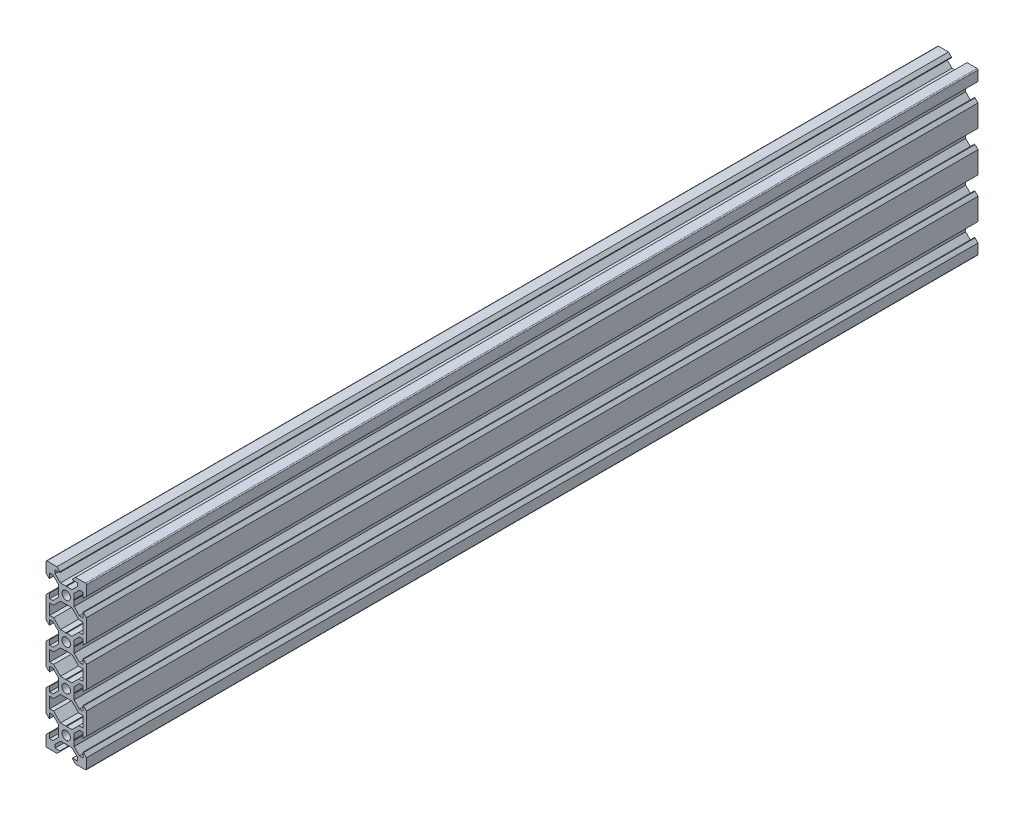
from build123d import *

# Parameters (mm, degrees)
BOSS_EXTRU_1_DEPTH = 441.2


with BuildPart() as part:
    # Esquisse1 → Boss.-Extru.1 (new body)
    with BuildSketch(Plane.XY):
        with BuildLine():
            Line((-9.5, 10), (-4.58, 10))
            Line((-4.58, 10), (-3.125, 8.545))
            Line((-3.125, 8.545), (-3.125, 8.2))
            Line((-3.125, 8.2), (-5.5, 8.2))
            Line((-5.5, 8.2), (-5.5, 6.560660172))
            Line((-5.5, 6.560660172), (-2.839339828, 3.9))
            Line((-2.839339828, 3.9), (-0.21, 3.9))
            Line((-0.21, 3.9), (0, 3.69))
            Line((0, 3.69), (0, 2.1))
            ThreePointArc((0, 2.1), (-2.1, 0), (0, -2.1))
            Line((0, -2.1), (0, -3.69))
            Line((0, -3.69), (-0.21, -3.9))
            Line((-0.21, -3.9), (-2.839339828, -3.9))
            Line((-2.839339828, -3.9), (-6.239339828, -7.3))
            Line((-6.239339828, -7.3), (-8.2, -7.3))
            Line((-8.2, -7.3), (-8.2, -12.7))
            Line((-8.2, -12.7), (-6.239339828, -12.7))
            Line((-6.239339828, -12.7), (-2.839339828, -16.1))
            Line((-2.839339828, -16.1), (-0.21, -16.1))
            Line((-0.21, -16.1), (0, -16.31))
            Line((0, -16.31), (0, -17.9))
            ThreePointArc((0, -17.9), (-2.1, -20), (0, -22.1))
            Line((0, -22.1), (0, -23.69))
            Line((0, -23.69), (-0.21, -23.9))
            Line((-0.21, -23.9), (-2.839339828, -23.9))
            Line((-2.839339828, -23.9), (-6.239339828, -27.3))
            Line((-6.239339828, -27.3), (-8.2, -27.3))
            Line((-8.2, -27.3), (-8.2, -32.7))
            Line((-8.2, -32.7), (-6.239339828, -32.7))
            Line((-6.239339828, -32.7), (-2.839339828, -36.1))
            Line((-2.839339828, -36.1), (-0.21, -36.1))
            Line((-0.21, -36.1), (0, -36.31))
            Line((0, -36.31), (0, -37.9))
            ThreePointArc((0, -37.9), (-2.1, -40), (0, -42.1))
            Line((0, -42.1), (0, -43.69))
            Line((0, -43.69), (-0.21, -43.9))
            Line((-0.21, -43.9), (-2.839339828, -43.9))
            Line((-2.839339828, -43.9), (-6.239339828, -47.3))
            Line((-6.239339828, -47.3), (-8.2, -47.3))
            Line((-8.2, -47.3), (-8.2, -52.7))
            Line((-8.2, -52.7), (-6.239339828, -52.7))
            Line((-6.239339828, -52.7), (-2.839339828, -56.1))
            Line((-2.839339828, -56.1), (-0.21, -56.1))
            Line((-0.21, -56.1), (0, -56.31))
            Line((0, -56.31), (0, -57.9))
            ThreePointArc((0, -57.9), (-2.1, -60), (0, -62.1))
            Line((0, -62.1), (0, -63.69))
            Line((0, -63.69), (-0.21, -63.9))
            Line((-0.21, -63.9), (-2.839339828, -63.9))
            Line((-2.839339828, -63.9), (-5.5, -66.560660172))
            Line((-5.5, -66.560660172), (-5.5, -68.2))
            Line((-5.5, -68.2), (-3.125, -68.2))
            Line((-3.125, -68.2), (-3.125, -68.545))
            Line((-3.125, -68.545), (-4.58, -70))
            Line((-4.58, -70), (-9.5, -70))
            ThreePointArc((-9.5, -70), (-9.853553391, -69.853553391), (-10, -69.5))
            Line((-10, -69.5), (-10, -64.58))
            Line((-10, -64.58), (-8.545, -63.125))
            Line((-8.545, -63.125), (-8.2, -63.125))
            Line((-8.2, -63.125), (-8.2, -65.5))
            Line((-8.2, -65.5), (-6.560660172, -65.5))
            Line((-6.560660172, -65.5), (-3.9, -62.839339828))
            Line((-3.9, -62.839339828), (-3.9, -60.21))
            Line((-3.9, -60.21), (-3.69, -60))
            Line((-3.69, -60), (-3.9, -59.79))
            Line((-3.9, -59.79), (-3.9, -57.160660172))
            Line((-3.9, -57.160660172), (-6.560660172, -54.5))
            Line((-6.560660172, -54.5), (-8.2, -54.5))
            Line((-8.2, -54.5), (-8.2, -56.875))
            Line((-8.2, -56.875), (-8.545, -56.875))
            Line((-8.545, -56.875), (-10, -55.42))
            Line((-10, -55.42), (-10, -44.58))
            Line((-10, -44.58), (-8.545, -43.125))
            Line((-8.545, -43.125), (-8.2, -43.125))
            Line((-8.2, -43.125), (-8.2, -45.5))
            Line((-8.2, -45.5), (-6.560660172, -45.5))
            Line((-6.560660172, -45.5), (-3.9, -42.839339828))
            Line((-3.9, -42.839339828), (-3.9, -40.21))
            Line((-3.9, -40.21), (-3.69, -40))
            Line((-3.69, -40), (-3.9, -39.79))
            Line((-3.9, -39.79), (-3.9, -37.160660172))
            Line((-3.9, -37.160660172), (-6.560660172, -34.5))
            Line((-6.560660172, -34.5), (-8.2, -34.5))
            Line((-8.2, -34.5), (-8.2, -36.875))
            Line((-8.2, -36.875), (-8.545, -36.875))
            Line((-8.545, -36.875), (-10, -35.42))
            Line((-10, -35.42), (-10, -24.58))
            Line((-10, -24.58), (-8.545, -23.125))
            Line((-8.545, -23.125), (-8.2, -23.125))
            Line((-8.2, -23.125), (-8.2, -25.5))
            Line((-8.2, -25.5), (-6.560660172, -25.5))
            Line((-6.560660172, -25.5), (-3.9, -22.839339828))
            Line((-3.9, -22.839339828), (-3.9, -20.21))
            Line((-3.9, -20.21), (-3.69, -20))
            Line((-3.69, -20), (-3.9, -19.79))
            Line((-3.9, -19.79), (-3.9, -17.160660172))
            Line((-3.9, -17.160660172), (-6.560660172, -14.5))
            Line((-6.560660172, -14.5), (-8.2, -14.5))
            Line((-8.2, -14.5), (-8.2, -16.875))
            Line((-8.2, -16.875), (-8.545, -16.875))
            Line((-8.545, -16.875), (-10, -15.42))
            Line((-10, -15.42), (-10, -4.58))
            Line((-10, -4.58), (-8.545, -3.125))
            Line((-8.545, -3.125), (-8.2, -3.125))
            Line((-8.2, -3.125), (-8.2, -5.5))
            Line((-8.2, -5.5), (-6.560660172, -5.5))
            Line((-6.560660172, -5.5), (-3.9, -2.839339828))
            Line((-3.9, -2.839339828), (-3.9, -0.21))
            Line((-3.9, -0.21), (-3.69, 0))
            Line((-3.69, 0), (-3.9, 0.21))
            Line((-3.9, 0.21), (-3.9, 2.839339828))
            Line((-3.9, 2.839339828), (-6.560660172, 5.5))
            Line((-6.560660172, 5.5), (-8.2, 5.5))
            Line((-8.2, 5.5), (-8.2, 3.125))
            Line((-8.2, 3.125), (-8.545, 3.125))
            Line((-8.545, 3.125), (-10, 4.58))
            Line((-10, 4.58), (-10, 9.5))
            ThreePointArc((-10, 9.5), (-9.853553391, 9.853553391), (-9.5, 10))
        make_face()
    boss_extru_1 = extrude(amount=BOSS_EXTRU_1_DEPTH)

    # Symétrie1: Boss.-Extru.1 across plane
    add(boss_extru_1.mirror(Plane(origin=(0, 3.69, 441.2), x_dir=(0, 0, 1), z_dir=(-1, 0, 0))))


solid = part.part
